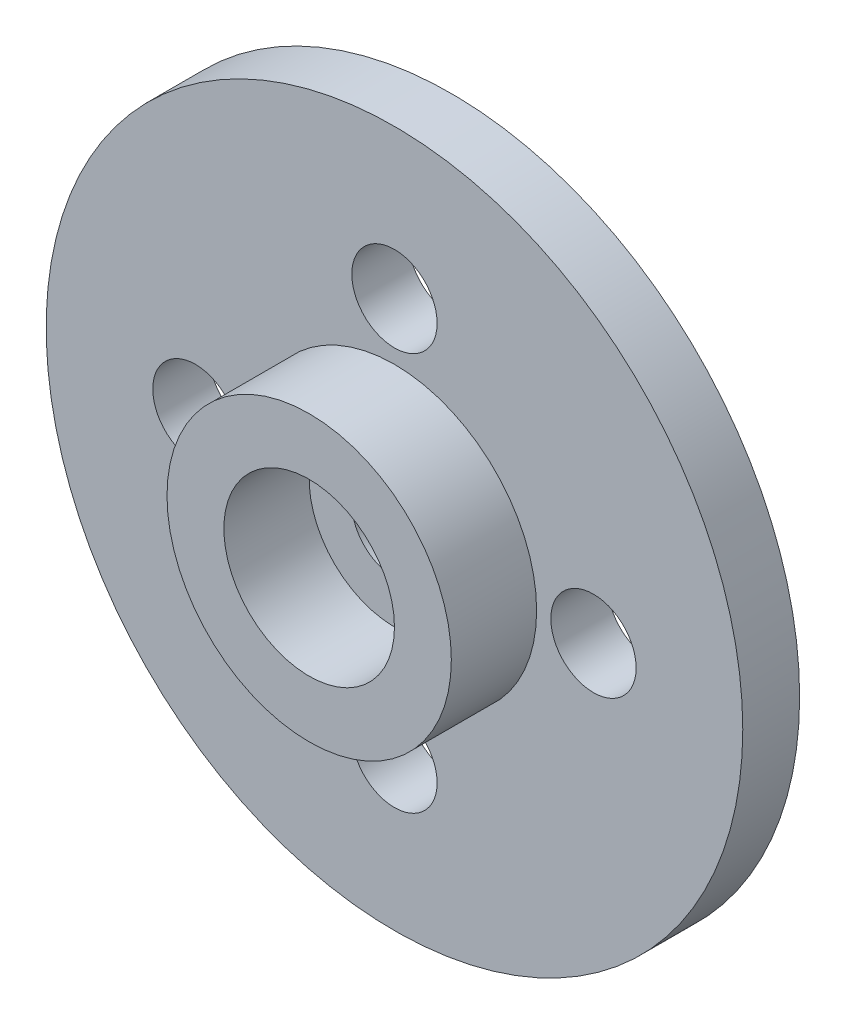
from build123d import *

# Parameters (mm, degrees)
SKETCH_1_R          = 12.25
SKETCH_1_R_2        = 1.5
EXTRUDE_1_DEPTH     = 2
SKETCH_2_R          = 5
SKETCH_2_R_2        = 3
EXTRUDE_2_DEPTH     = 3
EXTRUDE_3_DEPTH     = 2
SKETCH_4_R          = 1.5
CUT_EXTRUDE_1_DEPTH = 10
CUT_EXTRUDE_START   = -10
CUT_EXTRUDE_4_DEPTH = 10


with BuildPart() as part:
    # 草图1 → 凸台-拉伸1 (new body)
    with BuildSketch(Plane.XY):
        Circle(SKETCH_1_R)
        Circle(SKETCH_1_R_2, mode=Mode.SUBTRACT)
    extrude(amount=EXTRUDE_1_DEPTH)

    # 草图2 → 凸台-拉伸2 (add)
    with BuildSketch(Plane.XY.offset(2)):
        Circle(SKETCH_2_R)
        Circle(SKETCH_2_R_2, mode=Mode.SUBTRACT)
    extrude(amount=EXTRUDE_2_DEPTH)

    # 草图3 → 凸台-拉伸3 (add)
    with BuildSketch(Plane(origin=(0, 0, 0), x_dir=(-1, 0, 0), z_dir=(0, 0, -1))):
        with BuildLine():
            Line((12.030570384, -2.308219276), (-12.030570384, -2.308219276))
            Line((-12.030570384, -2.308219276), (-4.910436892, -39.418760727))
            ThreePointArc((-4.910436892, -39.418760727), (0, -43.47663041), (4.910436892, -39.418760727))
            Line((4.910436892, -39.418760727), (12.030570384, -2.308219276))
        make_face()
    extrude(amount=-EXTRUDE_3_DEPTH)

    # 草图4 → 切除-拉伸1 (cut)
    with BuildSketch(Plane(origin=(0, 0, 0), x_dir=(-1, 0, 0), z_dir=(0, 0, -1))):
        with Locations((7, 0)):
            Circle(SKETCH_4_R)
        with Locations((0, -7)):
            Circle(SKETCH_4_R)
        with Locations((-7, 0)):
            Circle(SKETCH_4_R)
        with Locations((0, 7)):
            Circle(SKETCH_4_R)
    extrude(amount=-CUT_EXTRUDE_1_DEPTH, mode=Mode.SUBTRACT)

    # 草图6 → 切除-拉伸4 (cut)
    with BuildSketch(Plane.XY.offset(2).offset(CUT_EXTRUDE_START)):
        with BuildLine():
            ThreePointArc((12.25, 0), (0, -12.25), (-12.25, 0))
            Line((-12.25, 0), (-14.856850111, -46.424662629))
            Line((-14.856850111, -46.424662629), (15.079980512, -43.09327684))
            Line((15.079980512, -43.09327684), (12.25, 0))
        make_face()
    extrude(amount=CUT_EXTRUDE_4_DEPTH, mode=Mode.SUBTRACT)


solid = part.part
